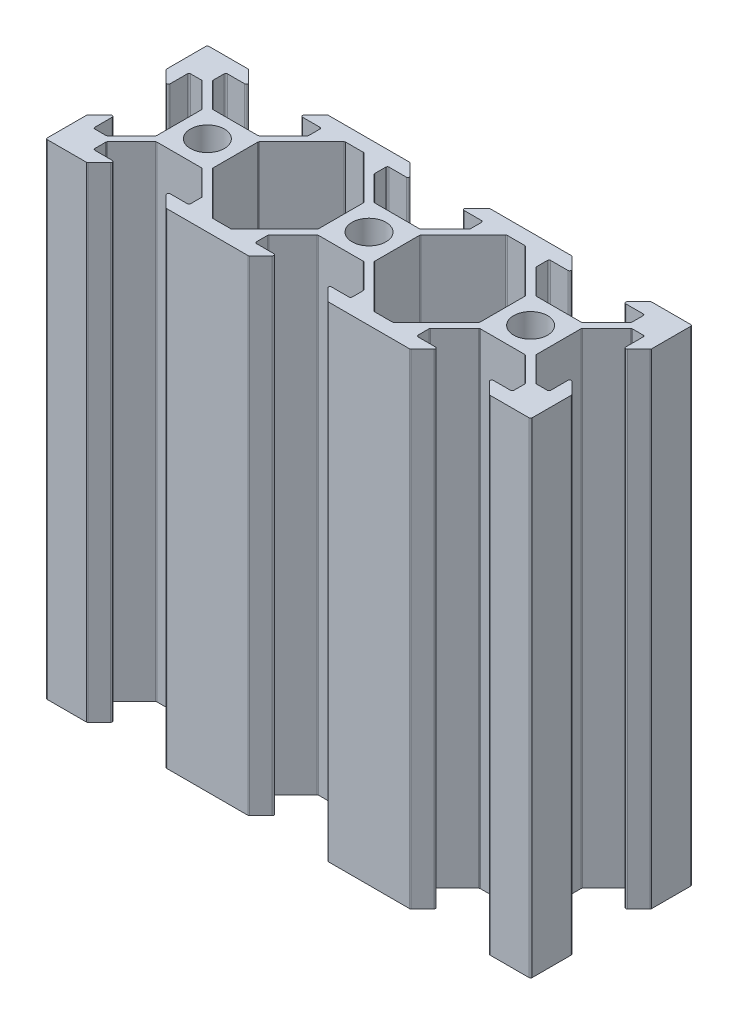
from build123d import *

# Parameters (mm, degrees)
EXTRUDE_1_DEPTH = 60
FILLET_1_R      = 0.2


with BuildPart() as part:
    # 草图1 → 凸台-拉伸1 (new body)
    with BuildSketch(Plane(origin=(0, 0, 0), x_dir=(1, 0, 0), z_dir=(0, 1, 0))):
        with BuildLine():
            Line((-3.476396103, 2.84), (-3.476396103, 0))
            Line((-3.476396103, 0), (-2.1, 0))
            ThreePointArc((-2.1, 0), (-1.48492424, 1.48492424), (0, 2.1))
            Line((0, 2.1), (0, 3.476396103))
            Line((0, 3.476396103), (-2.84, 3.476396103))
            Line((-2.84, 3.476396103), (-5.923603897, 6.56))
            Line((-5.923603897, 6.56), (-5.923603897, 8.2))
            Line((-5.923603897, 8.2), (-3.1, 8.2))
            Line((-3.1, 8.2), (-4.9, 10))
            Line((-4.9, 10), (-10, 10))
            Line((-10, 10), (-10, 4.9))
            Line((-10, 4.9), (-8.2, 3.1))
            Line((-8.2, 3.1), (-8.2, 5.923603897))
            Line((-8.2, 5.923603897), (-6.56, 5.923603897))
            Line((-6.56, 5.923603897), (-3.476396103, 2.84))
        make_face()
        with BuildLine():
            Line((-2.1, 0), (-3.476396103, 0))
            Line((-3.476396103, 0), (-3.476396103, -2.84))
            Line((-3.476396103, -2.84), (-6.56, -5.923603897))
            Line((-6.56, -5.923603897), (-8.2, -5.923603897))
            Line((-8.2, -5.923603897), (-8.2, -3.1))
            Line((-8.2, -3.1), (-10, -4.9))
            Line((-10, -4.9), (-10, -10))
            Line((-10, -10), (-4.9, -10))
            Line((-4.9, -10), (-3.1, -8.2))
            Line((-3.1, -8.2), (-5.923603897, -8.2))
            Line((-5.923603897, -8.2), (-5.923603897, -6.56))
            Line((-5.923603897, -6.56), (-2.84, -3.476396103))
            Line((-2.84, -3.476396103), (0, -3.476396103))
            Line((0, -3.476396103), (0, -2.1))
            ThreePointArc((0, -2.1), (-1.48492424, -1.48492424), (-2.1, 0))
        make_face()
        with BuildLine():
            ThreePointArc((2.1, 0), (1.48492424, -1.48492424), (0, -2.1))
            Line((0, -2.1), (0, -3.476396103))
            Line((0, -3.476396103), (2.84, -3.476396103))
            Line((2.84, -3.476396103), (5.923603897, -6.56))
            Line((5.923603897, -6.56), (5.923603897, -8.2))
            Line((5.923603897, -8.2), (3.1, -8.2))
            Line((3.1, -8.2), (4.9, -10))
            Line((4.9, -10), (15.1, -10))
            Line((15.1, -10), (16.9, -8.2))
            Line((16.9, -8.2), (14.076396103, -8.2))
            Line((14.076396103, -8.2), (14.076396103, -6.56))
            Line((14.076396103, -6.56), (17.16, -3.476396103))
            Line((17.16, -3.476396103), (20, -3.476396103))
            Line((20, -3.476396103), (20, -2.1))
            ThreePointArc((20, -2.1), (18.51507576, -1.48492424), (17.9, 0))
            Line((17.9, 0), (16.523603897, 0))
            Line((16.523603897, 0), (16.523603897, -2.84))
            Line((16.523603897, -2.84), (13.44, -5.923603897))
            Line((13.44, -5.923603897), (11.163603897, -8.2))
            Line((11.163603897, -8.2), (8.836396103, -8.2))
            Line((8.836396103, -8.2), (6.56, -5.923603897))
            Line((6.56, -5.923603897), (3.476396103, -2.84))
            Line((3.476396103, -2.84), (3.476396103, 0))
            Line((3.476396103, 0), (2.1, 0))
        make_face()
        with BuildLine():
            Line((0, 3.476396103), (0, 2.1))
            ThreePointArc((0, 2.1), (1.48492424, 1.48492424), (2.1, 0))
            Line((2.1, 0), (3.476396103, 0))
            Line((3.476396103, 0), (3.476396103, 2.84))
            Line((3.476396103, 2.84), (6.56, 5.923603897))
            Line((6.56, 5.923603897), (8.836396103, 8.2))
            Line((8.836396103, 8.2), (11.163603897, 8.2))
            Line((11.163603897, 8.2), (13.44, 5.923603897))
            Line((13.44, 5.923603897), (16.523603897, 2.84))
            Line((16.523603897, 2.84), (16.523603897, 0))
            Line((16.523603897, 0), (17.9, 0))
            ThreePointArc((17.9, 0), (18.51507576, 1.48492424), (20, 2.1))
            Line((20, 2.1), (20, 3.476396103))
            Line((20, 3.476396103), (17.16, 3.476396103))
            Line((17.16, 3.476396103), (14.076396103, 6.56))
            Line((14.076396103, 6.56), (14.076396103, 8.2))
            Line((14.076396103, 8.2), (16.9, 8.2))
            Line((16.9, 8.2), (15.1, 10))
            Line((15.1, 10), (4.9, 10))
            Line((4.9, 10), (3.1, 8.2))
            Line((3.1, 8.2), (5.923603897, 8.2))
            Line((5.923603897, 8.2), (5.923603897, 6.56))
            Line((5.923603897, 6.56), (2.84, 3.476396103))
            Line((2.84, 3.476396103), (0, 3.476396103))
        make_face()
        with BuildLine():
            Line((20, 3.476396103), (20, 2.1))
            ThreePointArc((20, 2.1), (21.48492424, 1.48492424), (22.1, 0))
            Line((22.1, 0), (23.476396103, 0))
            Line((23.476396103, 0), (23.476396103, 2.84))
            Line((23.476396103, 2.84), (26.56, 5.923603897))
            Line((26.56, 5.923603897), (28.836396103, 8.2))
            Line((28.836396103, 8.2), (31.163603897, 8.2))
            Line((31.163603897, 8.2), (33.44, 5.923603897))
            Line((33.44, 5.923603897), (36.523603897, 2.84))
            Line((36.523603897, 2.84), (36.523603897, 0))
            Line((36.523603897, 0), (37.9, 0))
            ThreePointArc((37.9, 0), (40, 2.1), (42.1, 0))
            Line((42.1, 0), (43.476396103, 0))
            Line((43.476396103, 0), (43.476396103, 2.84))
            Line((43.476396103, 2.84), (46.56, 5.923603897))
            Line((46.56, 5.923603897), (48.2, 5.923603897))
            Line((48.2, 5.923603897), (48.2, 3.1))
            Line((48.2, 3.1), (50, 4.9))
            Line((50, 4.9), (50, 10))
            Line((50, 10), (44.9, 10))
            Line((44.9, 10), (43.1, 8.2))
            Line((43.1, 8.2), (45.923603897, 8.2))
            Line((45.923603897, 8.2), (45.923603897, 6.56))
            Line((45.923603897, 6.56), (42.84, 3.476396103))
            Line((42.84, 3.476396103), (37.16, 3.476396103))
            Line((37.16, 3.476396103), (34.076396103, 6.56))
            Line((34.076396103, 6.56), (34.076396103, 8.2))
            Line((34.076396103, 8.2), (36.9, 8.2))
            Line((36.9, 8.2), (35.1, 10))
            Line((35.1, 10), (24.9, 10))
            Line((24.9, 10), (23.1, 8.2))
            Line((23.1, 8.2), (25.923603897, 8.2))
            Line((25.923603897, 8.2), (25.923603897, 6.56))
            Line((25.923603897, 6.56), (22.84, 3.476396103))
            Line((22.84, 3.476396103), (20, 3.476396103))
        make_face()
        with BuildLine():
            ThreePointArc((22.1, 0), (21.48492424, -1.48492424), (20, -2.1))
            Line((20, -2.1), (20, -3.476396103))
            Line((20, -3.476396103), (22.84, -3.476396103))
            Line((22.84, -3.476396103), (25.923603897, -6.56))
            Line((25.923603897, -6.56), (25.923603897, -8.2))
            Line((25.923603897, -8.2), (23.1, -8.2))
            Line((23.1, -8.2), (24.9, -10))
            Line((24.9, -10), (35.1, -10))
            Line((35.1, -10), (36.9, -8.2))
            Line((36.9, -8.2), (34.076396103, -8.2))
            Line((34.076396103, -8.2), (34.076396103, -6.56))
            Line((34.076396103, -6.56), (37.16, -3.476396103))
            Line((37.16, -3.476396103), (42.84, -3.476396103))
            Line((42.84, -3.476396103), (45.923603897, -6.56))
            Line((45.923603897, -6.56), (45.923603897, -8.2))
            Line((45.923603897, -8.2), (43.1, -8.2))
            Line((43.1, -8.2), (44.9, -10))
            Line((44.9, -10), (50, -10))
            Line((50, -10), (50, -4.9))
            Line((50, -4.9), (48.2, -3.1))
            Line((48.2, -3.1), (48.2, -5.923603897))
            Line((48.2, -5.923603897), (46.56, -5.923603897))
            Line((46.56, -5.923603897), (43.476396103, -2.84))
            Line((43.476396103, -2.84), (43.476396103, 0))
            Line((43.476396103, 0), (42.1, 0))
            ThreePointArc((42.1, 0), (40, -2.1), (37.9, 0))
            Line((37.9, 0), (36.523603897, 0))
            Line((36.523603897, 0), (36.523603897, -2.84))
            Line((36.523603897, -2.84), (33.44, -5.923603897))
            Line((33.44, -5.923603897), (31.163603897, -8.2))
            Line((31.163603897, -8.2), (28.836396103, -8.2))
            Line((28.836396103, -8.2), (26.56, -5.923603897))
            Line((26.56, -5.923603897), (23.476396103, -2.84))
            Line((23.476396103, -2.84), (23.476396103, 0))
            Line((23.476396103, 0), (22.1, 0))
        make_face()
    extrude(amount=EXTRUDE_1_DEPTH)

    # 圆角1
    fillet_1_edges = [part.edges().sort_by_distance(p)[0] for p in [
        (8.836396103, 30, 8.2),
        (11.163603897, 30, 8.2),
        (16.523603897, 30, 2.84),
        (16.523603897, 30, -2.84),
        (11.163603897, 30, -8.2),
        (8.836396103, 30, -8.2),
        (3.476396103, 30, -2.84),
        (3.476396103, 30, 2.84),
        (28.836396103, 30, 8.2),
        (31.163603897, 30, 8.2),
        (36.523603897, 30, 2.84),
        (36.523603897, 30, -2.84),
        (31.163603897, 30, -8.2),
        (28.836396103, 30, -8.2),
        (23.476396103, 30, -2.84),
        (23.476396103, 30, 2.84),
        (46.56, 30, 5.923603897),
        (48.2, 30, 5.923603897),
        (48.2, 30, 3.1),
        (50, 30, 4.9),
        (50, 30, 10),
        (44.9, 30, 10),
        (43.1, 30, 8.2),
        (45.923603897, 30, 8.2),
        (45.923603897, 30, 6.56),
        (42.84, 30, 3.476396103),
        (37.16, 30, 3.476396103),
        (34.076396103, 30, 6.56),
        (34.076396103, 30, 8.2),
        (36.9, 30, 8.2),
        (35.1, 30, 10),
        (24.9, 30, 10),
        (23.1, 30, 8.2),
        (25.923603897, 30, 8.2),
        (25.923603897, 30, 6.56),
        (22.84, 30, 3.476396103),
        (17.16, 30, 3.476396103),
        (14.076396103, 30, 6.56),
        (14.076396103, 30, 8.2),
        (16.9, 30, 8.2),
        (15.1, 30, 10),
        (4.9, 30, 10),
        (3.1, 30, 8.2),
        (5.923603897, 30, 8.2),
        (5.923603897, 30, 6.56),
        (2.84, 30, 3.476396103),
        (-2.84, 30, 3.476396103),
        (-5.923603897, 30, 6.56),
        (-5.923603897, 30, 8.2),
        (-3.1, 30, 8.2),
        (-4.9, 30, 10),
        (-10, 30, 10),
        (-10, 30, 4.9),
        (-8.2, 30, 3.1),
        (-8.2, 30, 5.923603897),
        (-6.56, 30, 5.923603897),
        (-3.476396103, 30, 2.84),
        (-3.476396103, 30, -2.84),
        (-6.56, 30, -5.923603897),
        (-8.2, 30, -5.923603897),
        (-8.2, 30, -3.1),
        (-10, 30, -4.9),
        (-10, 30, -10),
        (-4.9, 30, -10),
        (-3.1, 30, -8.2),
        (-5.923603897, 30, -8.2),
        (-5.923603897, 30, -6.56),
        (-2.84, 30, -3.476396103),
        (2.84, 30, -3.476396103),
        (5.923603897, 30, -6.56),
        (5.923603897, 30, -8.2),
        (3.1, 30, -8.2),
        (4.9, 30, -10),
        (15.1, 30, -10),
        (16.9, 30, -8.2),
        (14.076396103, 30, -8.2),
        (14.076396103, 30, -6.56),
        (17.16, 30, -3.476396103),
        (22.84, 30, -3.476396103),
        (25.923603897, 30, -6.56),
        (25.923603897, 30, -8.2),
        (23.1, 30, -8.2),
        (24.9, 30, -10),
        (35.1, 30, -10),
        (36.9, 30, -8.2),
        (34.076396103, 30, -8.2),
        (34.076396103, 30, -6.56),
        (37.16, 30, -3.476396103),
        (42.84, 30, -3.476396103),
        (45.923603897, 30, -6.56),
        (45.923603897, 30, -8.2),
        (43.1, 30, -8.2),
        (44.9, 30, -10),
        (50, 30, -10),
        (50, 30, -4.9),
        (48.2, 30, -3.1),
        (48.2, 30, -5.923603897),
        (46.56, 30, -5.923603897),
        (43.476396103, 30, -2.84),
        (43.476396103, 30, 2.84),
    ]]
    fillet(fillet_1_edges, radius=FILLET_1_R)


solid = part.part
